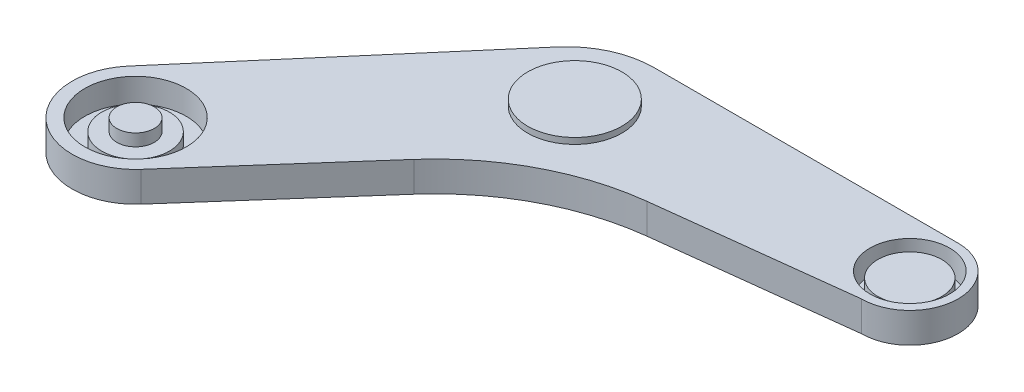
from build123d import *

# Parameters (mm, degrees)
BOSS_EXTRUDE2_DEPTH = 50
SKETCH4_R           = 84
CUT_EXTRUDE1_DEPTH  = 40
SKETCH5_R           = 66
CUT_EXTRUDE2_DEPTH  = 40
SKETCH6_R           = 56
BOSS_EXTRUDE3_DEPTH = 20
SKETCH7_R           = 31
BOSS_EXTRUDE4_DEPTH = 20
SKETCH8_R           = 53
BOSS_EXTRUDE5_DEPTH = 30
SKETCH9_R           = 81.118790055
BOSS_EXTRUDE6_DEPTH = 10
SKETCH10_R          = 77.994904394
BOSS_EXTRUDE7_DEPTH = 10


with BuildPart() as part:
    # Sketch3 → Boss-Extrude2 (new body)
    with BuildSketch(Plane(origin=(0, 0, 0), x_dir=(1, 0, 0), z_dir=(0, 1, 0))):
        with BuildLine():
            Line((-426.753144047, -312.117374747), (-99.343882551, 70.106841813))
            ThreePointArc((-99.343882551, 70.106841813), (-49.831824853, 107.501926674), (10.778427661, 120.777224017))
            Line((10.778427661, 120.777224017), (514.059836256, 120.777224017))
            ThreePointArc((514.059836256, 120.777224017), (594.059836256, 40.777224017), (514.059836256, -39.222775983))
            Line((514.059836256, -39.222775983), (196.291302455, -76.947554654))
            ThreePointArc((196.291302455, -76.947554654), (57.544015582, -119.983155247), (-56.683941268, -209.731951378))
            Line((-56.683941268, -209.731951378), (-268.224957691, -449.836925027))
            ThreePointArc((-268.224957691, -449.836925027), (-415.870847806, -459.691045091), (-426.753144047, -312.117374747))
        make_face()
    extrude(amount=BOSS_EXTRUDE2_DEPTH)

    # Sketch4 → Cut-Extrude1 (cut)
    with BuildSketch(Plane(origin=(0, 50, 0), x_dir=(1, 0, 0), z_dir=(0, 1, 0))):
        with Locations(Location((-347.009402169, -380.425029013, 0), (0, 0, 270))):
            Circle(SKETCH4_R)
    extrude(amount=-CUT_EXTRUDE1_DEPTH, mode=Mode.SUBTRACT)

    # Sketch5 → Cut-Extrude2 (cut)
    with BuildSketch(Plane(origin=(0, 50, 0), x_dir=(1, 0, 0), z_dir=(0, 1, 0))):
        with Locations(Location((514.059836256, 40.777224017, 0), (0, 0, 270))):
            Circle(SKETCH5_R)
    extrude(amount=-CUT_EXTRUDE2_DEPTH, mode=Mode.SUBTRACT)

    # Sketch6 → Boss-Extrude3 (add)
    with BuildSketch(Plane(origin=(0, 10, 0), x_dir=(1, 0, 0), z_dir=(0, 1, 0))):
        with Locations(Location((-347.009402169, -380.425029013, 0), (0, 0, 270))):
            Circle(SKETCH6_R)
    extrude(amount=BOSS_EXTRUDE3_DEPTH)

    # Sketch7 → Boss-Extrude4 (add)
    with BuildSketch(Plane(origin=(0, 30, 0), x_dir=(1, 0, 0), z_dir=(0, 1, 0))):
        with Locations(Location((-347.009402169, -380.425029013, 0), (0, 0, 270))):
            Circle(SKETCH7_R)
    extrude(amount=BOSS_EXTRUDE4_DEPTH)

    # Sketch8 → Boss-Extrude5 (add)
    with BuildSketch(Plane(origin=(0, 10, 0), x_dir=(1, 0, 0), z_dir=(0, 1, 0))):
        with Locations(Location((514.059836256, 40.777224017, 0), (0, 0, 270))):
            Circle(SKETCH8_R)
    extrude(amount=BOSS_EXTRUDE5_DEPTH)

    # Sketch9 → Boss-Extrude6 (add)
    with BuildSketch(Plane.XZ):
        with Locations(Location((0, 0, 0), (0, 0, 270))):
            Circle(SKETCH9_R)
    extrude(amount=BOSS_EXTRUDE6_DEPTH)

    # Sketch10 → Boss-Extrude7 (add)
    with BuildSketch(Plane(origin=(0, 50, 0), x_dir=(1, 0, 0), z_dir=(0, 1, 0))):
        with Locations(Location((0, 0, 0), (0, 0, 270))):
            Circle(SKETCH10_R)
    extrude(amount=BOSS_EXTRUDE7_DEPTH)


solid = part.part
